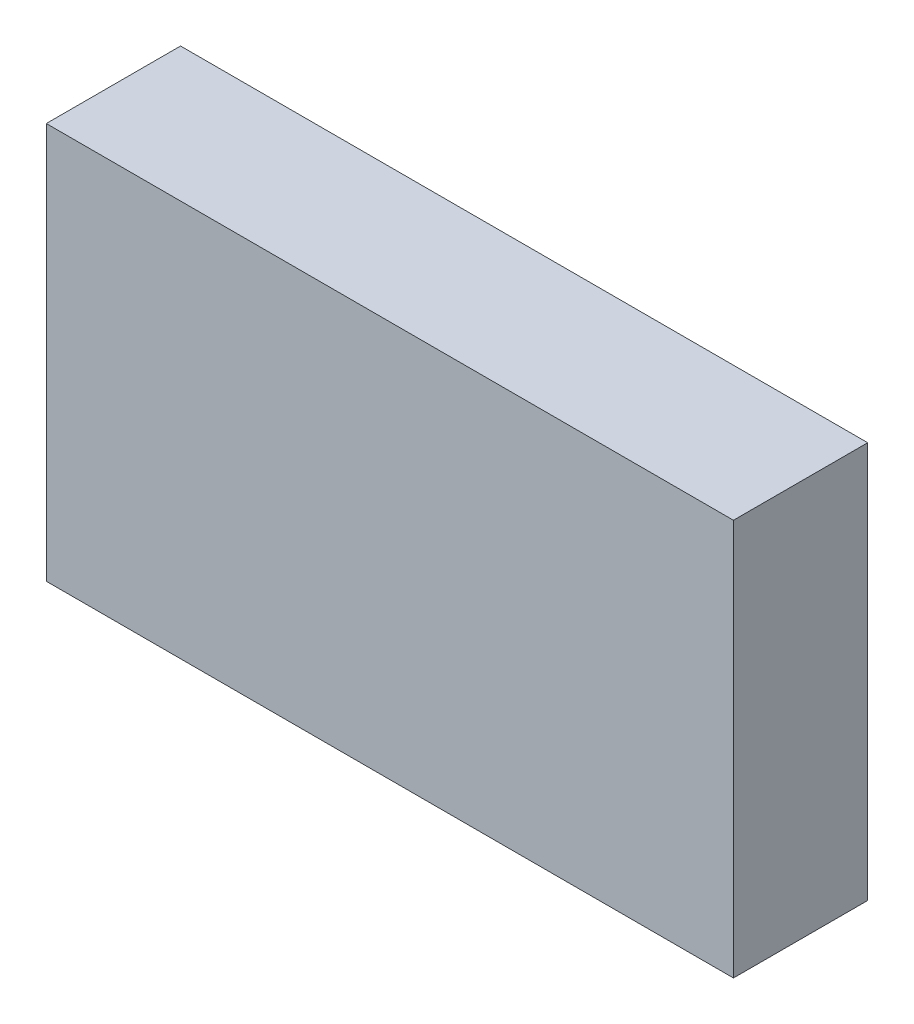
from build123d import *

# Parameters (mm, degrees)
SKETCH3_W           = 130
SKETCH3_H           = 75
BOSS_EXTRUDE1_DEPTH = 25.4


with BuildPart() as part:
    # Sketch3 → Boss-Extrude1 (new body)
    with BuildSketch(Plane.XY):
        with Locations((0, -37.5)):
            Rectangle(SKETCH3_W, SKETCH3_H)
    extrude(amount=BOSS_EXTRUDE1_DEPTH)


solid = part.part
